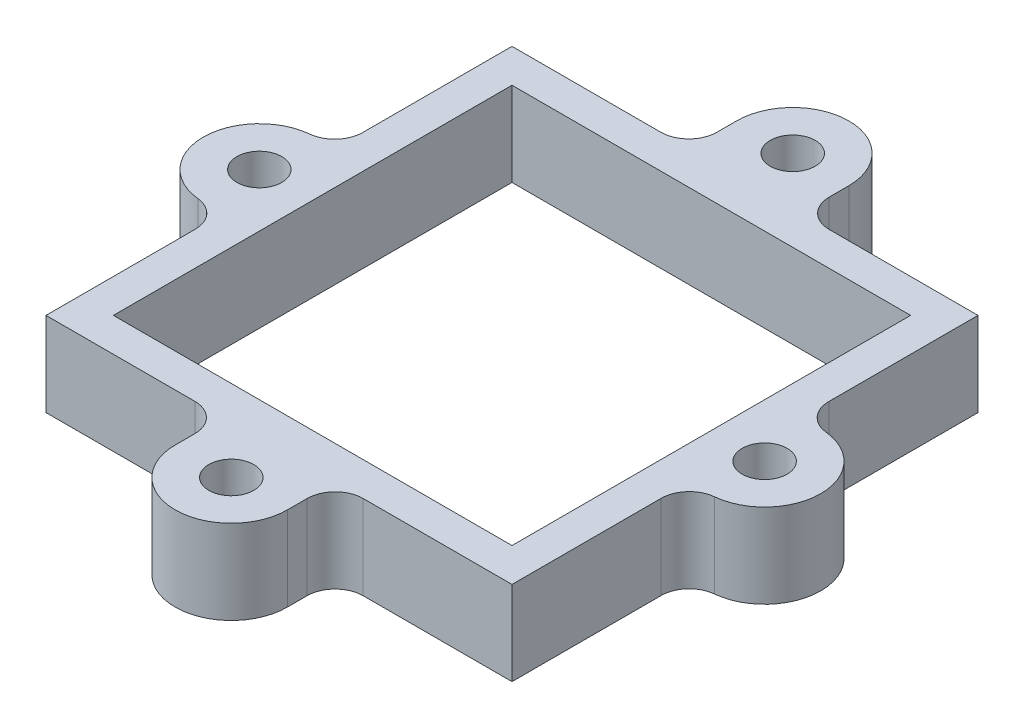
from build123d import *

# Parameters (mm, degrees)
SKETCH1_W           = 14.2
SKETCH1_H           = 14.2
BOSS_EXTRUDE1_DEPTH = 3
SKETCH2_R           = 0.8
CUT_EXTRUDE1_DEPTH  = 17.552945357
FILLET1_R           = 1


with BuildPart() as part:
    # Sketch1 → Boss-Extrude1 (new body)
    with BuildSketch(Plane(origin=(0, 0, 0), x_dir=(1, 0, 0), z_dir=(0, 1, 0))):
        with BuildLine():
            Line((-9, 2), (-8.3, 2))
            Line((-8.3, 2), (-8.3, 8.3))
            Line((-8.3, 8.3), (-2, 8.3))
            Line((-2, 8.3), (-2, 10))
            ThreePointArc((-2, 10), (0, 12), (2, 10))
            Line((2, 10), (2, 8.3))
            Line((2, 8.3), (8.3, 8.3))
            Line((8.3, 8.3), (8.3, 2))
            Line((8.3, 2), (9, 2))
            ThreePointArc((9, 2), (11, 0), (9, -2))
            Line((9, -2), (8.3, -2))
            Line((8.3, -2), (8.3, -8.3))
            Line((8.3, -8.3), (2, -8.3))
            Line((2, -8.3), (2, -10))
            ThreePointArc((2, -10), (0, -12), (-2, -10))
            Line((-2, -10), (-2, -8.3))
            Line((-2, -8.3), (-8.3, -8.3))
            Line((-8.3, -8.3), (-8.3, -2))
            Line((-8.3, -2), (-9, -2))
            ThreePointArc((-9, -2), (-11, 0), (-9, 2))
        make_face()
        Rectangle(SKETCH1_W, SKETCH1_H, mode=Mode.SUBTRACT)
    extrude(amount=BOSS_EXTRUDE1_DEPTH)

    # Sketch2 → Cut-Extrude1 (cut, through all)
    with BuildSketch(Plane(origin=(0, 3, 0), x_dir=(1, 0, 0), z_dir=(0, 1, 0))):
        with Locations(Location((0, 10, 0), (0, 0, 270))):
            Circle(SKETCH2_R)
        with Locations(Location((9, 0, 0), (0, 0, 270))):
            Circle(SKETCH2_R)
        with Locations(Location((0, -10, 0), (0, 0, 270))):
            Circle(SKETCH2_R)
        with Locations(Location((-9, 0, 0), (0, 0, 270))):
            Circle(SKETCH2_R)
    extrude(amount=-CUT_EXTRUDE1_DEPTH, mode=Mode.SUBTRACT)

    # Fillet1
    fillet1_edges = [part.edges().sort_by_distance(p)[0] for p in [
        (-2, 1.5, 8.3),
        (2, 1.5, 8.3),
        (8.3, 1.5, 2),
        (8.3, 1.5, -2),
        (2, 1.5, -8.3),
        (-2, 1.5, -8.3),
        (-8.3, 1.5, -2),
        (-8.3, 1.5, 2),
    ]]
    fillet(fillet1_edges, radius=FILLET1_R)


solid = part.part
